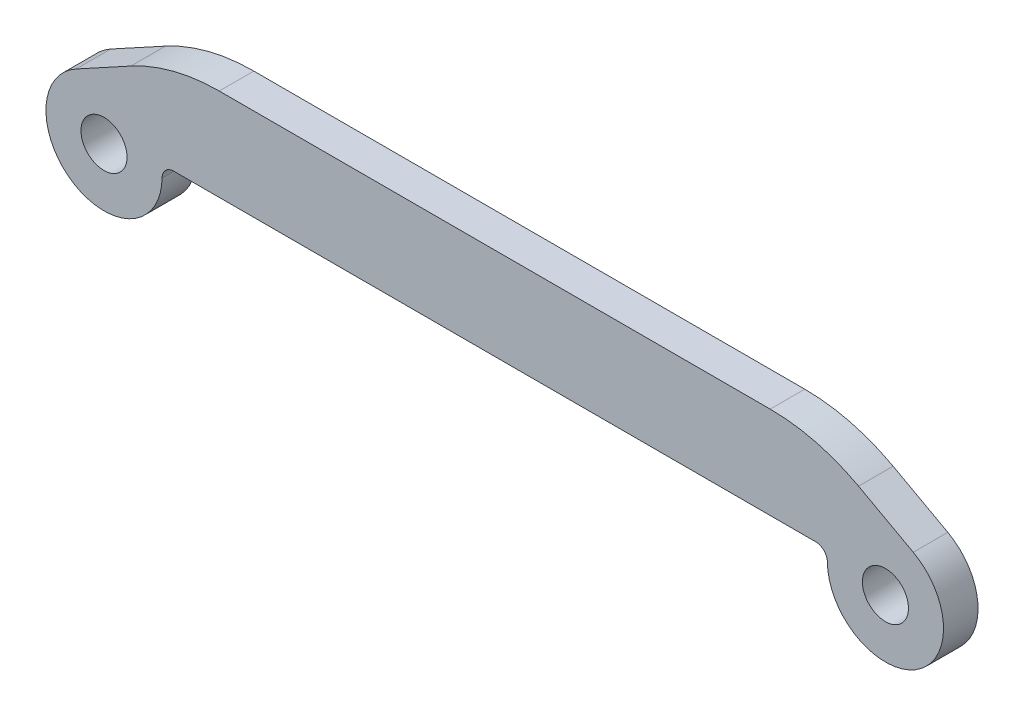
from build123d import *
from OCP.BRepFilletAPI import BRepFilletAPI_MakeFillet

# Parameters (mm, degrees)
SKETCH1_R           = 1.5875
BOSS_EXTRUDE1_DEPTH = 1.190625
FILLET1_R1          = 12.7
FILLET1_R2          = 0.8128


with BuildPart() as part:
    # Sketch1 → Boss-Extrude1 (new, symmetric)
    with BuildSketch(Plane.XY):
        with BuildLine():
            Line((-22.225, 0), (22.225, 0))
            Line((22.225, 0), (28.841565542, -3.6137254))
            ThreePointArc((28.841565542, -3.6137254), (28.620767438, -10.747541497), (22.999227375, -6.35))
            Line((22.999227375, -6.35), (0, -6.35))
            Line((0, -6.35), (-22.999227375, -6.35))
            ThreePointArc((-22.999227375, -6.35), (-28.620767438, -10.747541497), (-28.841565542, -3.6137254))
            Line((-28.841565542, -3.6137254), (-22.225, 0))
        make_face()
        with Locations((-26.924, -7.1247)):
            Circle(SKETCH1_R, mode=Mode.SUBTRACT)
        with Locations((26.924, -7.1247)):
            Circle(SKETCH1_R, mode=Mode.SUBTRACT)
    extrude(amount=BOSS_EXTRUDE1_DEPTH, both=True)

    # Fillet1: one fillet with a radius per group of edges: ONE call of the kernel's fillet builder (fillet() takes one radius for all edges)
    fillet1_edges_1 = [part.edges().sort_by_distance(p)[0] for p in [
        (-22.225, 0, 0),
        (22.225, 0, 0),
    ]]
    fillet1_edges_2 = [part.edges().sort_by_distance(p)[0] for p in [
        (22.999227375, -6.35, 0),
        (-22.999227375, -6.35, 0),
    ]]
    fillet1 = BRepFilletAPI_MakeFillet(part.part.solid().wrapped)
    for e in fillet1_edges_1:
        fillet1.Add(FILLET1_R1, e.wrapped)
    for e in fillet1_edges_2:
        fillet1.Add(FILLET1_R2, e.wrapped)
    add(Compound.cast(fillet1.Shape()), mode=Mode.REPLACE)


solid = part.part
